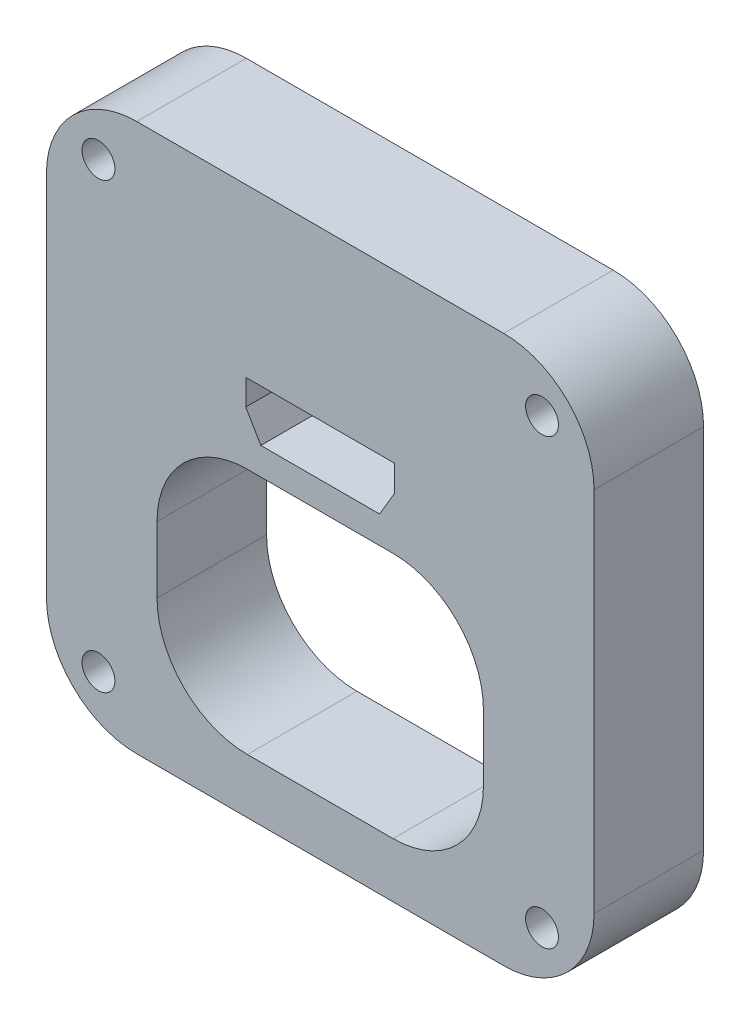
from build123d import *

# Parameters (mm, degrees)
BOSS_EXTRUDE1_DEPTH = 5.08
CUT_EXTRUDE1_DEPTH  = 5.08
SKETCH3_R           = 0.762
CUT_EXTRUDE2_DEPTH  = 5.08


with BuildPart() as part:
    # Sketch1 → Boss-Extrude1 (new body)
    with BuildSketch(Plane.XY):
        with BuildLine():
            Line((-8.509, -12.7), (8.509, -12.7))
            ThreePointArc((8.509, -12.7), (11.47248452, -11.47248452), (12.7, -8.509))
            Line((12.7, -8.509), (12.7, 8.509))
            ThreePointArc((12.7, 8.509), (11.47248452, 11.47248452), (8.509, 12.7))
            Line((8.509, 12.7), (-8.509, 12.7))
            ThreePointArc((-8.509, 12.7), (-11.47248452, 11.47248452), (-12.7, 8.509))
            Line((-12.7, 8.509), (-12.7, -8.509))
            ThreePointArc((-12.7, -8.509), (-11.47248452, -11.47248452), (-8.509, -12.7))
        make_face()
    extrude(amount=BOSS_EXTRUDE1_DEPTH)

    # Sketch2 → Cut-Extrude1 (cut)
    with BuildSketch(Plane(origin=(0, 0, 0), x_dir=(-1, 0, 0), z_dir=(0, 0, -1))):
        Polygon((-2.7559, 2.5654), (0, 2.5654), (0, 4.953), (-3.4544, 4.953), (-3.4544, 3.7592), align=None)
        Polygon((0, 4.953), (0, 2.5654), (2.7559, 2.5654), (3.4544, 3.7592), (3.4544, 4.953), align=None)
        with BuildLine():
            ThreePointArc((-7.5692, -2.8956), (-6.34168452, 0.06788452), (-3.3782, 1.2954))
            Line((-3.3782, 1.2954), (3.3782, 1.2954))
            ThreePointArc((3.3782, 1.2954), (6.34168452, 0.06788452), (7.5692, -2.8956))
            Line((7.5692, -2.8956), (7.5692, -5.969))
            ThreePointArc((7.5692, -5.969), (6.34168452, -8.93248452), (3.3782, -10.16))
            Line((3.3782, -10.16), (-3.3782, -10.16))
            ThreePointArc((-3.3782, -10.16), (-6.34168452, -8.93248452), (-7.5692, -5.969))
            Line((-7.5692, -5.969), (-7.5692, -2.8956))
        make_face()
    extrude(amount=-CUT_EXTRUDE1_DEPTH, mode=Mode.SUBTRACT)

    # Sketch3 → Cut-Extrude2 (cut)
    with BuildSketch(Plane(origin=(0, 0, 0), x_dir=(-1, 0, 0), z_dir=(0, 0, -1))):
        with Locations((10.287, -10.287)):
            Circle(SKETCH3_R)
        with Locations((-10.287, -10.287)):
            Circle(SKETCH3_R)
        with Locations((-10.287, 10.287)):
            Circle(SKETCH3_R)
        with Locations(Location((10.287, 10.287, 0), (0, 0, 180))):
            Circle(SKETCH3_R)
    extrude(amount=-CUT_EXTRUDE2_DEPTH, mode=Mode.SUBTRACT)


solid = part.part
